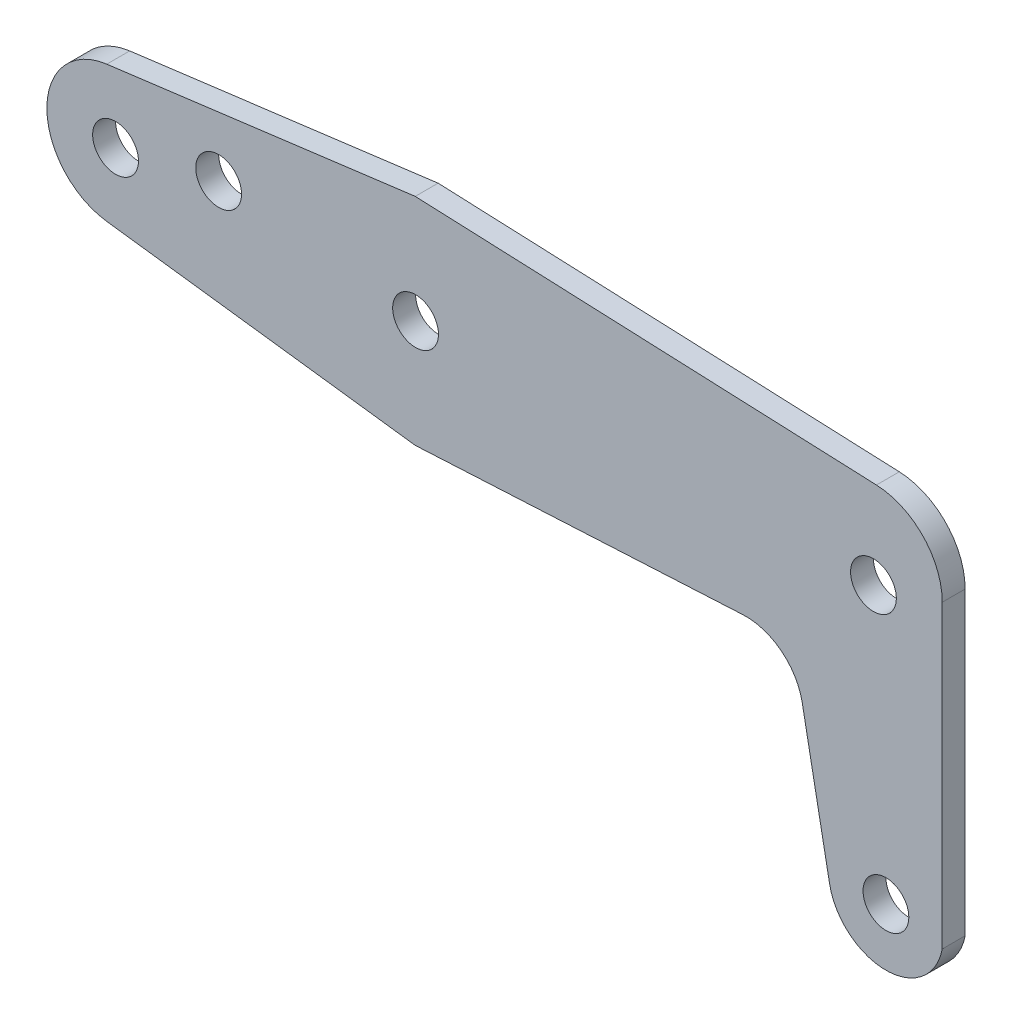
from build123d import *

# Parameters (mm, degrees)
BOSS_EXTRUDE1_DEPTH = 3.175
SKETCH2_R           = 3.175
CUT_EXTRUDE1_DEPTH  = 87.033766175


with BuildPart() as part:
    # Sketch1 → Boss-Extrude1 (new body)
    with BuildSketch(Plane.XY):
        with BuildLine():
            Line((-42.82323198, 9.447015826), (-0.046249169, 14.954781853))
            Line((-0.046249169, 14.954781853), (63.914748375, 12.26924))
            ThreePointArc((63.914748375, 12.26924), (70.390184722, 9.345032033), (73.04017255, 2.752624837))
            Line((73.04017255, 2.752624837), (73.04017255, -38.893945713))
            ThreePointArc((73.04017255, -38.893945713), (65.231134486, -45.352634886), (57.422096421, -38.893945713))
            Line((57.422096421, -38.893945713), (53.624835968, -19.012795079))
            ThreePointArc((53.624835968, -19.012795079), (50.720085476, -14.247018679), (45.398312666, -12.56507508))
            Line((45.398312666, -12.56507508), (-0.046249169, -14.954781853))
            Line((-0.046249169, -14.954781853), (-42.82323198, -9.447015826))
            ThreePointArc((-42.82323198, -9.447015826), (-51.131878011, 0), (-42.82323198, 9.447015826))
        make_face()
    extrude(amount=BOSS_EXTRUDE1_DEPTH)

    # Sketch2 → Cut-Extrude1 (cut, through all)
    with BuildSketch(Plane.XY.offset(3.175)):
        with Locations((-41.606878011, 0)):
            Circle(SKETCH2_R)
        with Locations((-27.306678011, 3.175)):
            Circle(SKETCH2_R)
        Circle(SKETCH2_R)
        with Locations((63.5, 0.037204921)):
            Circle(SKETCH2_R)
        with Locations((65.231134486, -37.402434886)):
            Circle(SKETCH2_R)
    extrude(amount=-CUT_EXTRUDE1_DEPTH, mode=Mode.SUBTRACT)


solid = part.part
